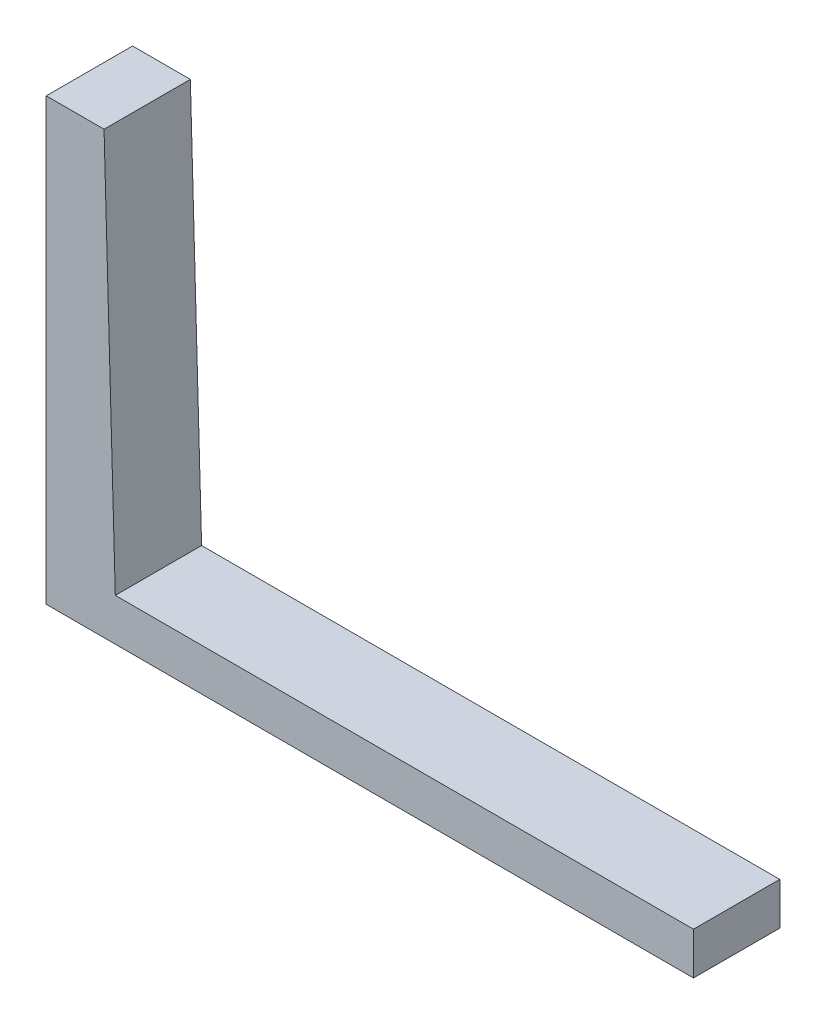
from build123d import *

# Parameters (mm, degrees)
EXTRUDE_1_DEPTH = 5


with BuildPart() as part:
    # 草图1 → 凸台-拉伸1 (new, symmetric)
    with BuildSketch(Plane.XY):
        Polygon((-37.5, 0), (37.5, 0), (37.5, 4.898825927), (-29.498225953, 4.898825927), (-30.801394861, 51.031005283), (-37.5, 51.031005283), align=None)
    extrude(amount=EXTRUDE_1_DEPTH, both=True)


solid = part.part
